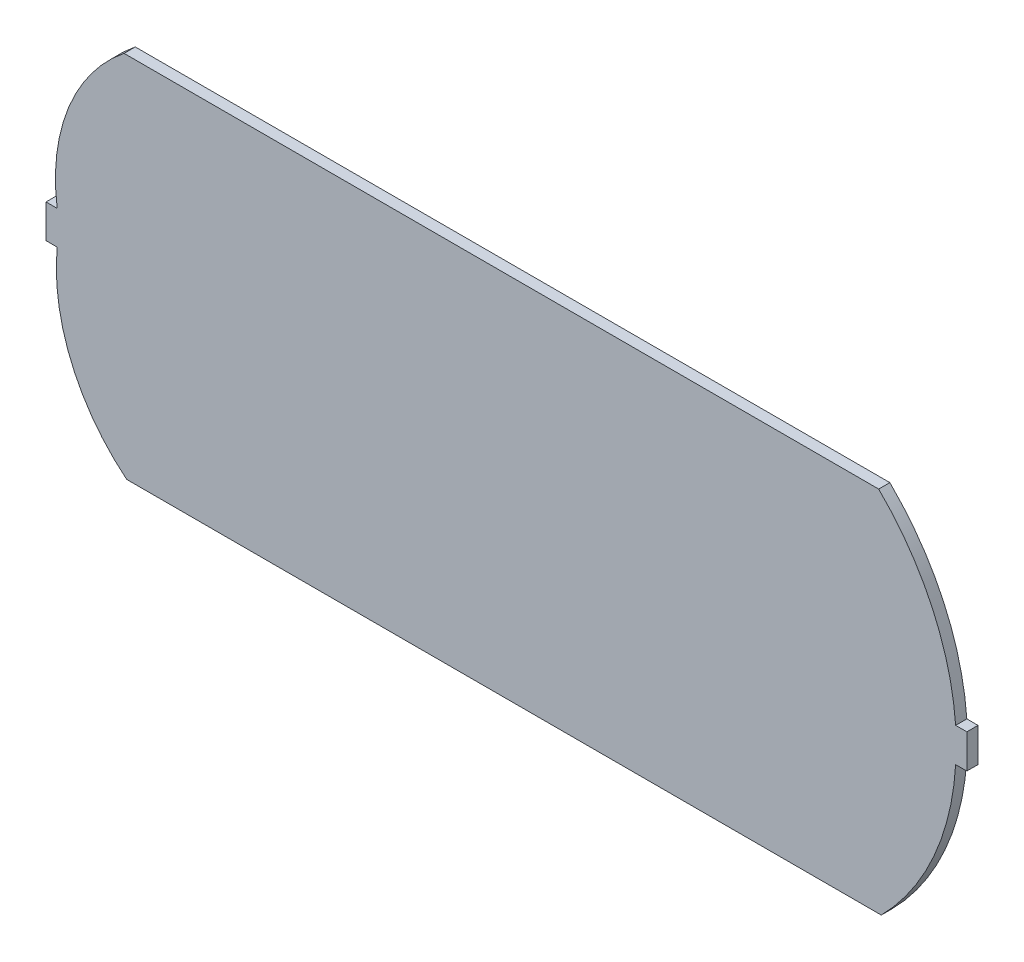
from build123d import *

# Parameters (mm, degrees)
BOSS_EXTRUDE1_DEPTH = 1


with BuildPart() as part:
    # cover → Boss-Extrude1 (new body)
    with BuildSketch(Plane.XY):
        with BuildLine():
            Line((20.444562716, -0.850883997), (87.944562716, -0.850883997))
            ThreePointArc((87.944562716, -0.850883997), (92.738800071, -7.656716494), (94.828442149, -15.715094978))
            Line((94.828442149, -15.715094978), (95.828442149, -15.715094978))
            Line((95.828442149, -15.715094978), (95.828442149, -18.75636772))
            Line((95.828442149, -18.75636772), (94.828442149, -18.75636772))
            ThreePointArc((94.828442149, -18.75636772), (92.86792134, -26.853915137), (88.176028155, -33.738684876))
            Line((88.176028155, -33.738684876), (20.676028155, -33.738684876))
            ThreePointArc((20.676028155, -33.738684876), (15.70120872, -27.073848015), (14.460674913, -18.850104667))
            Line((14.460674913, -18.850104667), (13.460674913, -18.850104667))
            Line((13.460674913, -18.850104667), (13.460674913, -15.850104667))
            Line((13.460674913, -15.850104667), (14.460674913, -15.850104667))
            ThreePointArc((14.460674913, -15.850104667), (15.467856256, -7.558680095), (20.444562716, -0.850883997))
        make_face()
    extrude(amount=BOSS_EXTRUDE1_DEPTH)


solid = part.part
